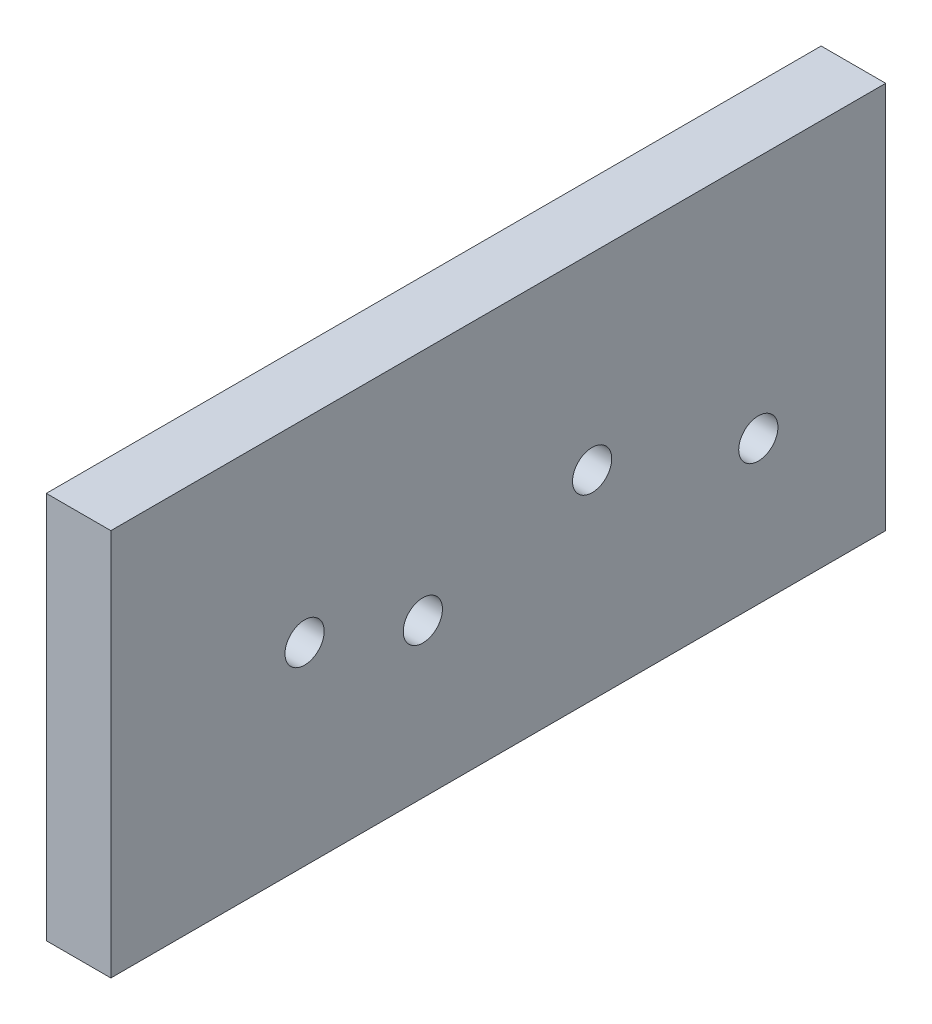
from build123d import *

# Parameters (mm, degrees)
SKETCH1_W                       = 152.4
SKETCH1_H                       = 76.2
SKETCH1_R                       = 3.854557775
BOSS_EXTRUDE1_DEPTH             = 12.7
F_1_4_0_25_DIAMETER_HOLE2_D     = 6.35
F_1_4_0_25_DIAMETER_HOLE2_DEPTH = 38.1
F_1_4_0_25_DIAMETER_HOLE2_TIP   = 1.907732465
SKETCH2_R                       = 7.9375
CUT_EXTRUDE1_DEPTH              = 5.08


with BuildPart() as part:
    # Sketch1 → Boss-Extrude1 (new body)
    with BuildSketch(Plane(origin=(0, 0, 0), x_dir=(0, 0, -1), z_dir=(1, 0, 0))):
        Rectangle(SKETCH1_W, SKETCH1_H)
        with Locations((18.457733582, 1.096077429)):
            Circle(SKETCH1_R, mode=Mode.SUBTRACT)
        with Locations((-38.1, 0)):
            Circle(SKETCH1_R, mode=Mode.SUBTRACT)
        with Locations((-14.836022013, -7.860160654)):
            Circle(SKETCH1_R, mode=Mode.SUBTRACT)
        with Locations((51.143457994, -9.873506971)):
            Circle(SKETCH1_R, mode=Mode.SUBTRACT)
    extrude(amount=BOSS_EXTRUDE1_DEPTH)

    # 1/4 (0.25) Diameter Hole2
    with Locations(Plane.XZ.offset(38.1)):
        with Locations((6.35, 57.15), (6.35, -63.5), (6.35, 0)):
            Hole(F_1_4_0_25_DIAMETER_HOLE2_D / 2, depth=F_1_4_0_25_DIAMETER_HOLE2_DEPTH)
            with Locations((0, 0, -(F_1_4_0_25_DIAMETER_HOLE2_DEPTH + F_1_4_0_25_DIAMETER_HOLE2_TIP / 2))):  # 118° drill point
                Cone(0, F_1_4_0_25_DIAMETER_HOLE2_D / 2, F_1_4_0_25_DIAMETER_HOLE2_TIP, mode=Mode.SUBTRACT)

    # Sketch2 → Cut-Extrude1 (cut)
    with BuildSketch(Plane.ZY):
        with Locations((38.1, 0)):
            Circle(SKETCH2_R)
        with Locations((14.836022013, -7.860160654)):
            Circle(SKETCH2_R)
        with Locations((-18.457733582, 1.096077429)):
            Circle(SKETCH2_R)
        with Locations((-51.143457994, -9.873506971)):
            Circle(SKETCH2_R)
    extrude(amount=-CUT_EXTRUDE1_DEPTH, mode=Mode.SUBTRACT)


solid = part.part
